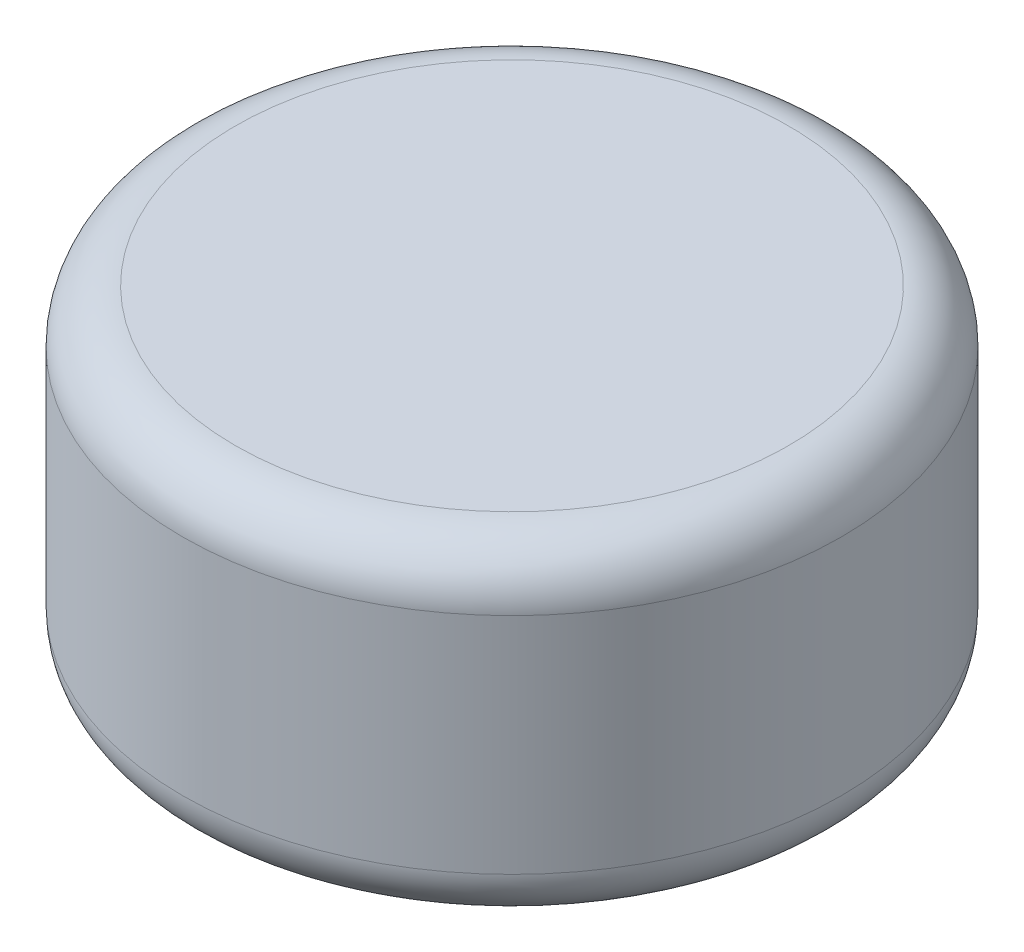
from build123d import *

# Parameters (mm, degrees)
SKETCH1_R           = 1.5875
BOSS_EXTRUDE1_DEPTH = 1.5875
FILLET1_R           = 0.254


with BuildPart() as part:
    # Sketch1 → Boss-Extrude1 (new body)
    with BuildSketch(Plane(origin=(0, 0, 0), x_dir=(1, 0, 0), z_dir=(0, 1, 0))):
        with Locations(Location((0, 0, 0), (0, 0, 270))):
            Circle(SKETCH1_R)
    extrude(amount=BOSS_EXTRUDE1_DEPTH)

    # Fillet1
    fillet1_edges = [part.edges().sort_by_distance(p)[0] for p in [
        (0, 0, -1.5875),
        (0, 1.5875, -1.5875),
    ]]
    fillet(fillet1_edges, radius=FILLET1_R)


solid = part.part
